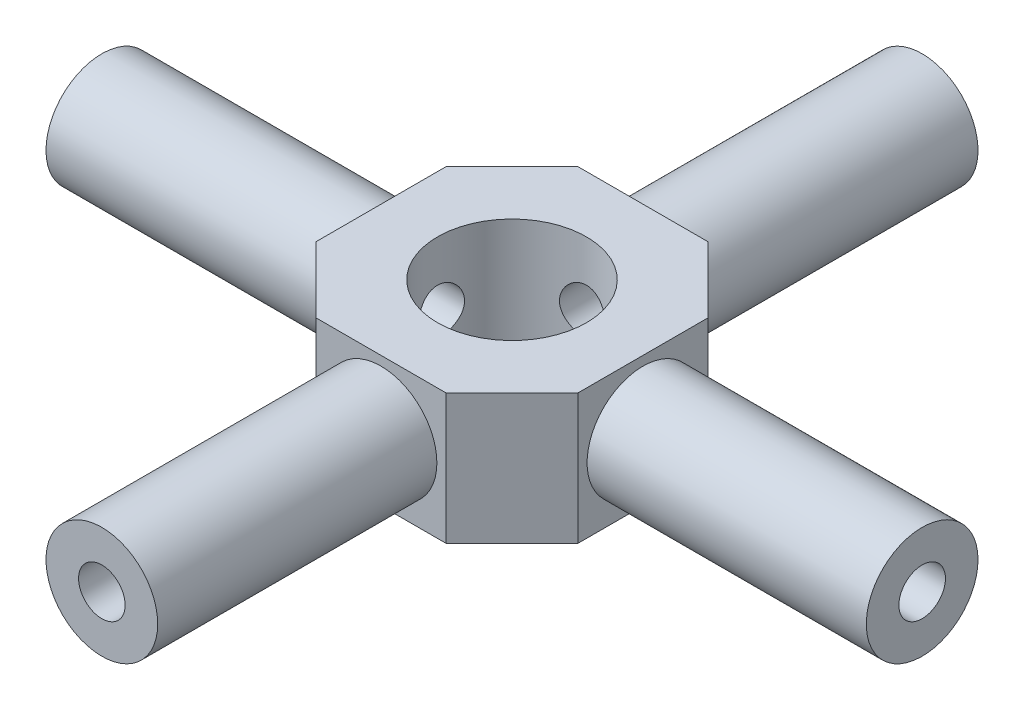
from build123d import *

# Parameters (mm, degrees)
HUB_DEPTH                         = 14
SKETCH4_R                         = 6
ARM_INSERT_1_DEPTH                = 30
SKETCH5_R                         = 6
ARM_INSERT_2_DEPTH                = 30
ARM_START                         = 30
SKETCH6_R                         = 6
ARM_INSERT_3_DEPTH                = 30
SKETCH7_R                         = 6
ARM_INSERT_4_DEPTH                = 30
SKETCH8_R                         = 8
HUB_LIGHTENING_HOLE_DEPTH         = 64.878932647
SKETCH9_R                         = 2.5
ARM_1_AND_3_LIGHTENING_HOLE_DEPTH = 100.535396168
SKETCH10_R                        = 2.5
ARM_2_AND_4_LIGHTENING_HOLE_DEPTH = 100.535396227


with BuildPart() as part:
    # Sketch1 → Hub (new body)
    with BuildSketch(Plane(origin=(0, 0, 0), x_dir=(1, 0, 0), z_dir=(0, 1, 0))):
        Polygon((14.071067812, 7), (14.071067812, -7), (7, -14.071067812), (-7, -14.071067812), (-14.071067812, -7), (-14.071067812, 7), (-7, 14.071067812), (7, 14.071067812), align=None)
    extrude(amount=HUB_DEPTH)

    # Sketch4 → Arm Insert 1 (add)
    with BuildSketch(Plane.XY.offset(14.071067812)):
        with Locations((0, 7)):
            Circle(SKETCH4_R)
    extrude(amount=ARM_INSERT_1_DEPTH)

    # Sketch5 → Arm Insert 2 (add)
    with BuildSketch(Plane(origin=(14.071067812, 0, 0), x_dir=(0, 0, -1), z_dir=(1, 0, 0))):
        with Locations((0, 7)):
            Circle(SKETCH5_R)
    extrude(amount=ARM_INSERT_2_DEPTH)

    # Sketch6 → Arm Insert 3 (add)
    with BuildSketch(Plane(origin=(0, 0, -14.071067812), x_dir=(-1, 0, 0), z_dir=(0, 0, -1)).offset(ARM_START)):
        with Locations(Location((0, 7, 0), (0, 0, 180))):
            Circle(SKETCH6_R)
    extrude(amount=-ARM_INSERT_3_DEPTH)

    # Sketch7 → Arm Insert 4 (add)
    with BuildSketch(Plane.ZY.offset(14.071067812).offset(ARM_START)):
        with Locations(Location((0, 7, 0), (0, 0, 180))):
            Circle(SKETCH7_R)
    extrude(amount=-ARM_INSERT_4_DEPTH)

    # Sketch8 → Hub Lightening Hole (cut, through all)
    with BuildSketch(Plane(origin=(0, 14, 0), x_dir=(1, 0, 0), z_dir=(0, 1, 0))):
        with Locations(Location((0, 0, 0), (0, 0, 270))):
            Circle(SKETCH8_R)
    extrude(amount=-HUB_LIGHTENING_HOLE_DEPTH, mode=Mode.SUBTRACT)

    # Sketch9 → Arm 1 and 3 Lightening Hole (cut, through all)
    with BuildSketch(Plane.XY.offset(44.071067812)):
        with Locations((0, 7)):
            Circle(SKETCH9_R)
    extrude(amount=-ARM_1_AND_3_LIGHTENING_HOLE_DEPTH, mode=Mode.SUBTRACT)

    # Sketch10 → Arm 2 and 4 Lightening Hole (cut, through all)
    with BuildSketch(Plane(origin=(44.071067812, 0, 0), x_dir=(0, 0, -1), z_dir=(1, 0, 0))):
        with Locations((0, 7)):
            Circle(SKETCH10_R)
    extrude(amount=-ARM_2_AND_4_LIGHTENING_HOLE_DEPTH, mode=Mode.SUBTRACT)


solid = part.part
